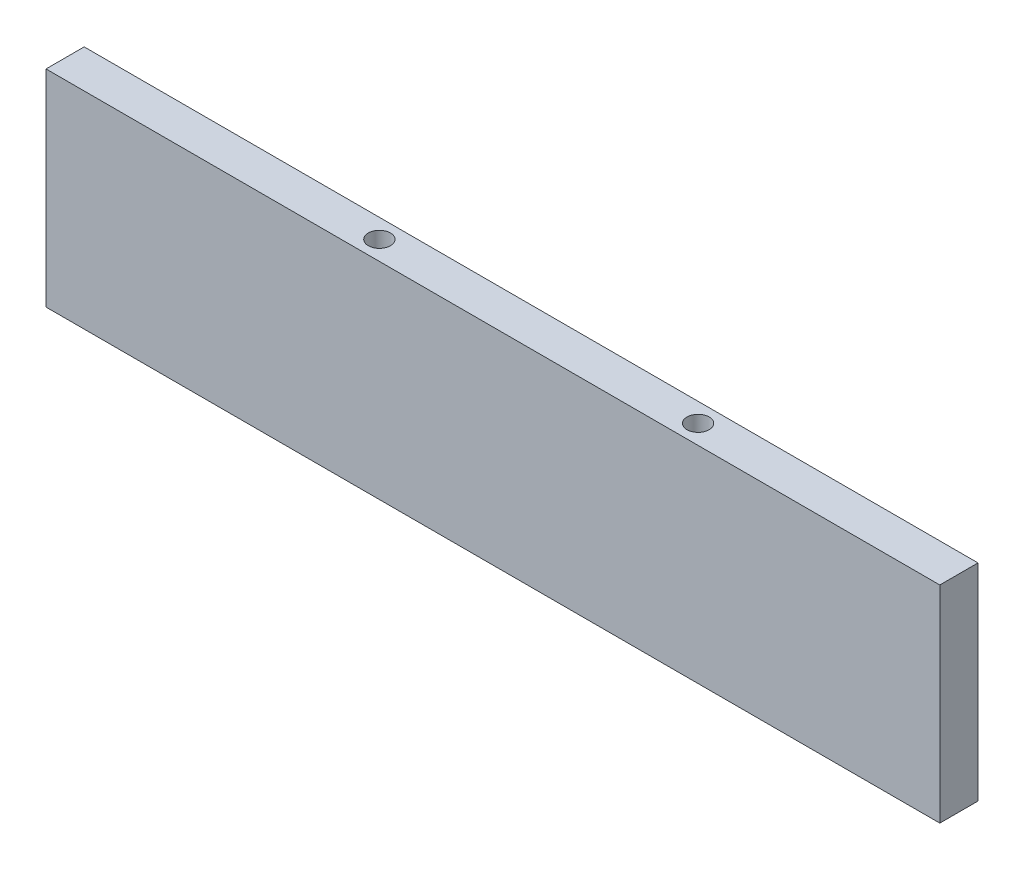
from build123d import *

# Parameters (mm, degrees)
SKETCH_1_W          = 117
SKETCH_1_H          = 5
EXTRUDE_1_DEPTH     = 27
SKETCH_2_R          = 1.45
CUT_EXTRUDE_1_DEPTH = 30


with BuildPart() as part:
    # 草图1 → 凸台-拉伸1 (new body)
    with BuildSketch(Plane(origin=(0, 0, 0), x_dir=(1, 0, 0), z_dir=(0, 1, 0))):
        with Locations((-3.5, 0)):
            Rectangle(SKETCH_1_W, SKETCH_1_H)
    extrude(amount=EXTRUDE_1_DEPTH)

    # 草图2 → 切除-拉伸1 (cut)
    with BuildSketch(Plane(origin=(0, 0, 0), x_dir=(1, 0, 0), z_dir=(0, 1, 0))):
        with Locations(Location((-20.86, 0, 0), (0, 0, 270))):
            Circle(SKETCH_2_R)
        with Locations(Location((20.86, 0, 0), (0, 0, 90))):
            Circle(SKETCH_2_R)
    extrude(amount=CUT_EXTRUDE_1_DEPTH, mode=Mode.SUBTRACT)


solid = part.part
